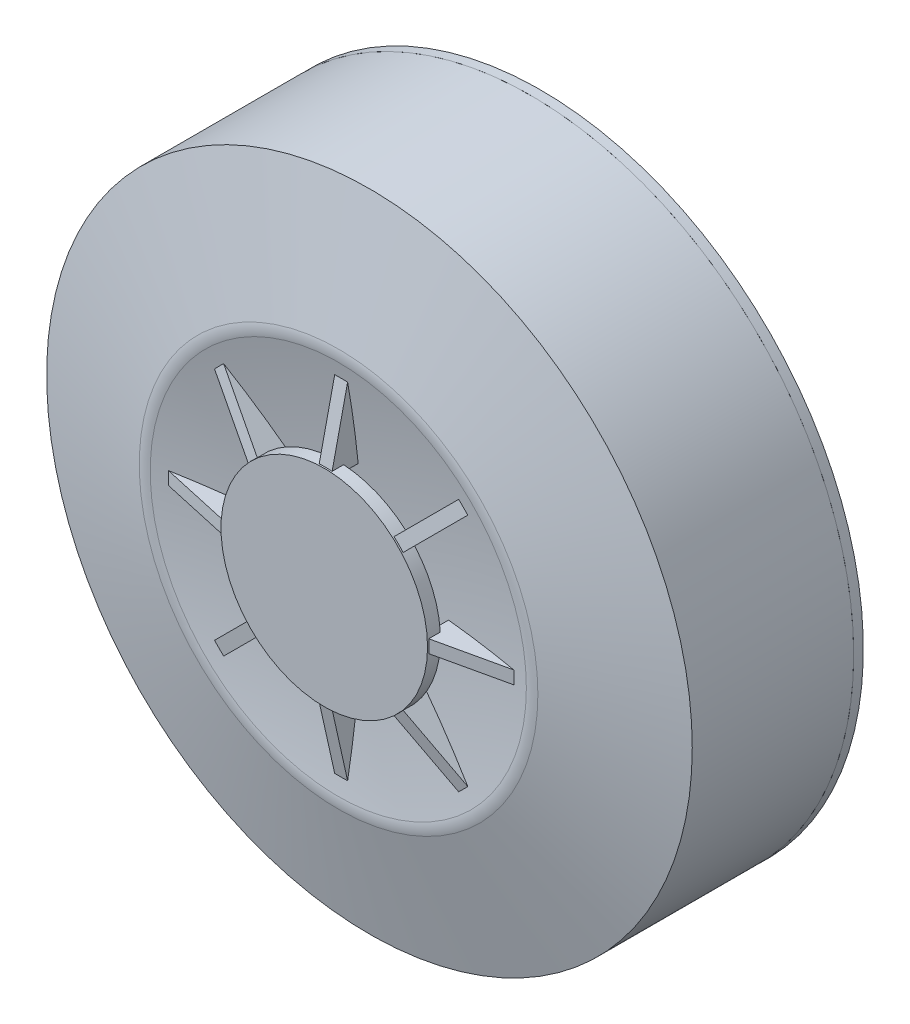
from build123d import *

# Parameters (mm, degrees)
SKETCH1_R           = 50
BOSS_EXTRUDE1_DEPTH = 30
FILLET1_R           = 4
SHELL1_T            = -2
SKETCH3_R           = 12.5
CUT_EXTRUDE1_DEPTH  = 77.773152366
SKETCH4_R           = 15
BOSS_EXTRUDE2_DEPTH = 2
BOSS_EXTRUDE3_DEPTH = 1
CIRPATTERN1_COUNT   = 8
SKETCH7_R           = 49
SKETCH7_R_2         = 48
CUT_EXTRUDE2_DEPTH  = 1
SKETCH8_R           = 50
BOSS_EXTRUDE4_DEPTH = 1.5
SKETCH9_R           = 49
SKETCH9_R_2         = 48
BOSS_EXTRUDE5_DEPTH = 1
MOVE_FACE1_BY       = 1


with BuildPart() as part:
    # Sketch1 → Boss-Extrude1 (new body)
    with BuildSketch(Plane.XY):
        Circle(SKETCH1_R)
    extrude(amount=BOSS_EXTRUDE1_DEPTH)

    # Sketch2 → Cut-Revolve1 (revolve, cut)
    with BuildSketch(Plane(origin=(0, 0, 0), x_dir=(1, 0, 0), z_dir=(0, 1, 0))):
        with BuildLine():
            Line((-50, -25), (-30, -30))
            ThreePointArc((-30, -30), (-15.074813432, -27.751865683), (0, -27))
            Line((0, -27), (0, -49.365581707))
            Line((0, -49.365581707), (-56.685327812, -49.365581707))
            Line((-56.685327812, -49.365581707), (-56.685327812, -25))
            Line((-56.685327812, -25), (-50, -25))
        make_face()
    revolve(axis=Axis((0, 0, 49.365581707), (0, 0, -1)), mode=Mode.SUBTRACT)

    # Fillet1
    fillet1_edges = [part.edges().sort_by_distance(p)[0] for p in [
        (30, 0, 30),
    ]]
    fillet(fillet1_edges, radius=FILLET1_R)

    # Shell1
    shell1_openings = [part.faces().sort_by_distance(p)[0] for p in [
        (0, 0, 0),
    ]]
    offset(amount=SHELL1_T, openings=shell1_openings)

    # Sketch3 → Cut-Extrude1 (cut, through all)
    with BuildSketch(Plane.XY):
        Circle(SKETCH3_R)
    extrude(amount=CUT_EXTRUDE1_DEPTH, mode=Mode.SUBTRACT)

    # Sketch5 → Boss-Extrude3 (add, symmetric)
    with BuildSketch(Plane(origin=(0, 0, 0), x_dir=(0, 0, -1), z_dir=(0, 1, 0))):
        with BuildLine():
            Line((-32, 15), (-29.101204824, 28))
            ThreePointArc((-29.101204824, 28), (-28.031113562, 21.52008862), (-27.241942363, 15))
            Line((-27.241942363, 15), (-32, 15))
        make_face()
    boss_extrude3 = extrude(amount=BOSS_EXTRUDE3_DEPTH, both=True)

    # CirPattern1: Boss-Extrude3 ×8 about axis
    cirpattern1_axis = Axis((0, 0, 32), (0, 0, -1))
    for i in range(1, CIRPATTERN1_COUNT):
        add(boss_extrude3.rotate(cirpattern1_axis, i * 360 / CIRPATTERN1_COUNT))

    # Sketch7 → Cut-Extrude2 (cut)
    with BuildSketch(Plane(origin=(0, 0, 0), x_dir=(-1, 0, 0), z_dir=(0, 0, -1))):
        Circle(SKETCH7_R)
        Circle(SKETCH7_R_2, mode=Mode.SUBTRACT)
    extrude(amount=-CUT_EXTRUDE2_DEPTH, mode=Mode.SUBTRACT)


with BuildPart() as body_2:
    # Sketch4 → Boss-Extrude2 (new body)
    with BuildSketch(Plane.XY.offset(30)):
        Circle(SKETCH4_R)
    extrude(amount=BOSS_EXTRUDE2_DEPTH)

    # Move Face1: a curved face moved outward by 1.0
    add(Solid.thicken(body_2.faces().sort_by_distance((-15, 0, 31))[0], MOVE_FACE1_BY))

    # Combine2: union part
    add(part.part)


with BuildPart() as body_3:
    # Sketch8 → Boss-Extrude4 (new body)
    with BuildSketch(Plane(origin=(0, 0, 0), x_dir=(-1, 0, 0), z_dir=(0, 0, -1))):
        Circle(SKETCH8_R)
    extrude(amount=BOSS_EXTRUDE4_DEPTH)

    # Sketch9 → Boss-Extrude5 (add)
    with BuildSketch(Plane.XY):
        Circle(SKETCH9_R)
        Circle(SKETCH9_R_2, mode=Mode.SUBTRACT)
    extrude(amount=BOSS_EXTRUDE5_DEPTH)


solid = Compound([body_2.part, body_3.part])
